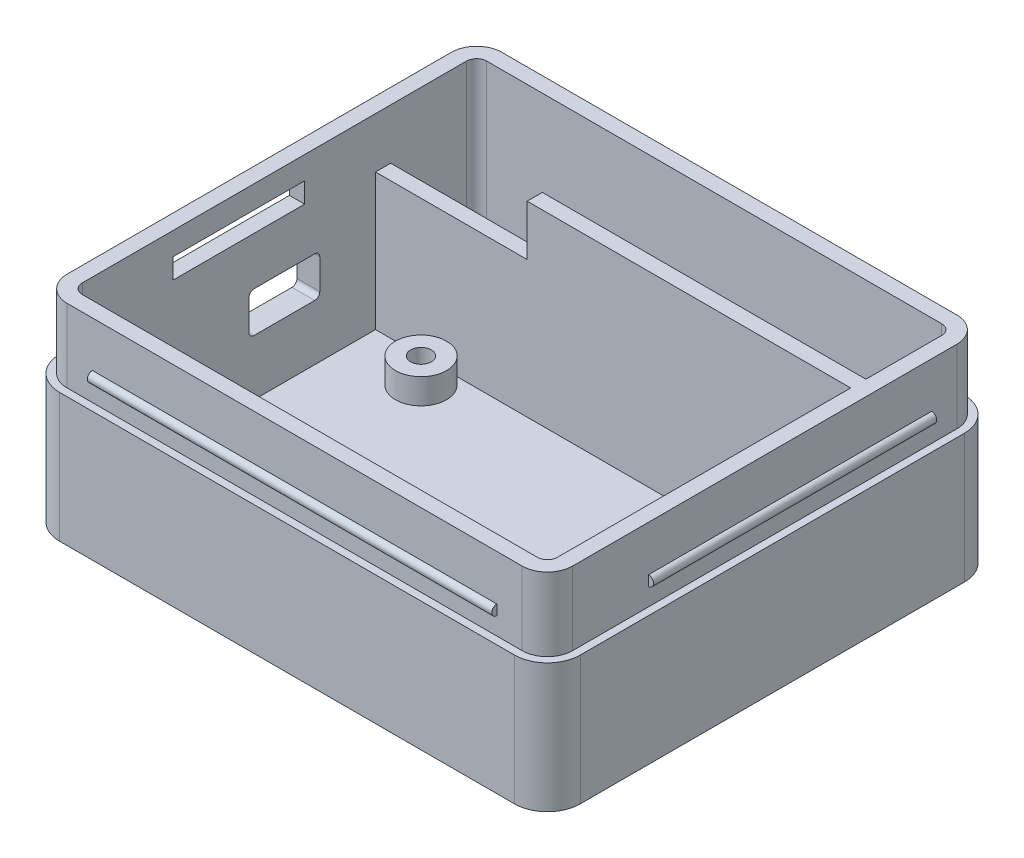
from build123d import *

# Parameters (mm, degrees)
ESQUISSE1_W             = 100
ESQUISSE1_H             = 66
BOSS_EXTRU_1_DEPTH      = 40
COQUE1_T                = -3
BOSS_EXTRU_2_DEPTH      = 40
ESQUISSE3_W             = 94
ESQUISSE3_H             = 17
BOSS_EXTRU_3_DEPTH      = 3
CONG_1_R                = 2
CONG_2_R                = 5
BOSS_EXTRU_4_START      = -10
BOSS_EXTRU_4_DEPTH      = 80
BOSS_EXTRU_5_START      = -10
BOSS_EXTRU_5_DEPTH      = 56
ESQUISSE6_W             = 30
ESQUISSE6_H             = 10
ENL_V_MAT_EXTRU_1_DEPTH = 5
ESQUISSE7_R             = 5.05
ESQUISSE7_R_2           = 5
BOSS_EXTRU_6_DEPTH      = 5
ESQUISSE8_R             = 2.05
ENL_V_MAT_EXTRU_2_DEPTH = 81.876448982
BOSS_EXTRU_7_START      = -25.5
BOSS_EXTRU_7_DEPTH      = 25.5
ESQUISSE11_W            = 14
ESQUISSE11_H            = 8
ENL_V_MAT_EXTRU_4_DEPTH = 10
CONG_3_R                = 1
ESQUISSE12_W            = 26
ESQUISSE12_H            = 4
ENL_V_MAT_EXTRU_5_DEPTH = 10


with BuildPart() as part:
    # Esquisse1 → Boss.-Extru.1 (new body)
    with BuildSketch(Plane(origin=(0, 0, 0), x_dir=(1, 0, 0), z_dir=(0, 1, 0))):
        Rectangle(ESQUISSE1_W, ESQUISSE1_H)
    extrude(amount=BOSS_EXTRU_1_DEPTH)

    # Coque1
    coque1_openings = [part.faces().sort_by_distance(p)[0] for p in [
        (0, 40, 0),
    ]]
    offset(amount=COQUE1_T, openings=coque1_openings, kind=Kind.INTERSECTION)

    # Esquisse2 → Boss.-Extru.2 (add)
    with BuildSketch(Plane.XZ):
        Polygon((-50, -33), (-50, -53), (50, -53), (50, -33), (47, -33), (47, -50), (-47, -50), (-47, -33), align=None)
    extrude(amount=-BOSS_EXTRU_2_DEPTH)

    # Esquisse3 → Boss.-Extru.3 (add)
    with BuildSketch(Plane.XZ):
        with Locations((0, -41.5)):
            Rectangle(ESQUISSE3_W, ESQUISSE3_H)
    extrude(amount=-BOSS_EXTRU_3_DEPTH)

    # Congé1
    cong_1_edges = [part.edges().sort_by_distance(p)[0] for p in [
        (47, 21.5, 30),
        (-47, 21.5, 30),
        (-47, 21.5, -50),
        (47, 21.5, -50),
    ]]
    fillet(cong_1_edges, radius=CONG_1_R)

    # Congé2
    cong_2_edges = [part.edges().sort_by_distance(p)[0] for p in [
        (50, 20, -53),
        (-50, 20, -53),
        (50, 20, 33),
        (-50, 20, 33),
    ]]
    fillet(cong_2_edges, radius=CONG_2_R)

    # Esquisse4 → Boss.-Extru.4 (add)
    with BuildSketch(Plane(origin=(50, 0, 0), x_dir=(0, 0, -1), z_dir=(1, 0, 0)).offset(BOSS_EXTRU_4_START)):
        with BuildLine():
            Line((-33, 31), (-33, 29))
            ThreePointArc((-33, 29), (-34, 30), (-33, 31))
        make_face()
    boss_extru_4 = extrude(amount=-BOSS_EXTRU_4_DEPTH)

    # Symétrie1: Boss.-Extru.4 across plane
    add(boss_extru_4.mirror(Plane(origin=(0, 0, -10), x_dir=(1, 0, 0), z_dir=(0, 0, -1))))

    # Esquisse5 → Boss.-Extru.5 (add)
    with BuildSketch(Plane(origin=(0, 0, -53), x_dir=(-1, 0, 0), z_dir=(0, 0, -1)).offset(BOSS_EXTRU_5_START)):
        with BuildLine():
            Line((50, 31), (50, 29))
            ThreePointArc((50, 29), (51, 30), (50, 31))
        make_face()
    boss_extru_5 = extrude(amount=-BOSS_EXTRU_5_DEPTH)

    # Symétrie2: Boss.-Extru.5 across plane
    add(boss_extru_5.mirror(Plane(origin=(0, 0, 0), x_dir=(0, 0, 1), z_dir=(1, 0, 0))))

    # Esquisse6 → Enlèv. mat.-Extru.1 (cut)
    with BuildSketch(Plane.XY.offset(-30)):
        with Locations((-32, 35)):
            Rectangle(ESQUISSE6_W, ESQUISSE6_H)
    extrude(amount=-ENL_V_MAT_EXTRU_1_DEPTH, mode=Mode.SUBTRACT)

    # Esquisse7 → Boss.-Extru.6 (add)
    with BuildSketch(Plane(origin=(0, 3, 0), x_dir=(1, 0, 0), z_dir=(0, 1, 0))):
        with Locations((-33, 25)):
            Circle(ESQUISSE7_R)
        with Locations(Location((-33, -24, 0), (0, 0, 90))):
            Circle(ESQUISSE7_R_2)
        with Locations(Location((39, -18, 0), (0, 0, 90))):
            Circle(ESQUISSE7_R_2)
        with Locations(Location((39, 10, 0), (0, 0, 90))):
            Circle(ESQUISSE7_R_2)
    extrude(amount=BOSS_EXTRU_6_DEPTH)

    # Esquisse8 → Enlèv. mat.-Extru.2 (cut, through all)
    with BuildSketch(Plane(origin=(0, 8, 0), x_dir=(1, 0, 0), z_dir=(0, 1, 0))):
        with Locations(Location((-33, 25, 0), (0, 0, 270))):
            Circle(ESQUISSE8_R)
        with Locations(Location((-33, -24, 0), (0, 0, 270))):
            Circle(ESQUISSE8_R)
        with Locations(Location((39, 10, 0), (0, 0, 270))):
            Circle(ESQUISSE8_R)
        with Locations(Location((39, -18, 0), (0, 0, 270))):
            Circle(ESQUISSE8_R)
    extrude(amount=-ENL_V_MAT_EXTRU_2_DEPTH, mode=Mode.SUBTRACT)

    # Esquisse10 → Boss.-Extru.7 (add)
    with BuildSketch(Plane.XZ.offset(BOSS_EXTRU_7_START)):
        with BuildLine():
            Line((-51.5, 28), (-51.5, -48))
            ThreePointArc((-51.5, -48), (-49.596194078, -52.596194078), (-45, -54.5))
            Line((-45, -54.5), (45, -54.5))
            ThreePointArc((45, -54.5), (49.596194078, -52.596194078), (51.5, -48))
            Line((51.5, -48), (51.5, 28))
            ThreePointArc((51.5, 28), (49.596194078, 32.596194078), (45, 34.5))
            Line((45, 34.5), (-45, 34.5))
            ThreePointArc((-45, 34.5), (-49.596194078, 32.596194078), (-51.5, 28))
        make_face()
        with BuildLine():
            Line((50, 28), (50, -48))
            ThreePointArc((50, -48), (48.535533906, -51.535533906), (45, -53))
            Line((45, -53), (-45, -53))
            ThreePointArc((-45, -53), (-48.535533906, -51.535533906), (-50, -48))
            Line((-50, -48), (-50, 28))
            ThreePointArc((-50, 28), (-48.535533906, 31.535533906), (-45, 33))
            Line((-45, 33), (45, 33))
            ThreePointArc((45, 33), (48.535533906, 31.535533906), (50, 28))
        make_face(mode=Mode.SUBTRACT)
    extrude(amount=BOSS_EXTRU_7_DEPTH)

    # Esquisse11 → Enlèv. mat.-Extru.4 (cut)
    with BuildSketch(Plane(origin=(-47, 0, 0), x_dir=(0, 0, -1), z_dir=(1, 0, 0))):
        with Locations((11.975, 18)):
            Rectangle(ESQUISSE11_W, ESQUISSE11_H)
    extrude(amount=-ENL_V_MAT_EXTRU_4_DEPTH, mode=Mode.SUBTRACT)

    # Congé3
    cong_3_edges = [part.edges().sort_by_distance(p)[0] for p in [
        (-49.25, 22, -18.975),
        (-49.25, 14, -18.975),
        (-49.25, 14, -4.975),
        (-49.25, 22, -4.975),
    ]]
    fillet(cong_3_edges, radius=CONG_3_R)

    # Esquisse12 → Enlèv. mat.-Extru.5 (cut)
    with BuildSketch(Plane(origin=(-47, 0, 0), x_dir=(0, 0, -1), z_dir=(1, 0, 0))):
        with Locations((2.975, 33.5)):
            Rectangle(ESQUISSE12_W, ESQUISSE12_H)
    extrude(amount=-ENL_V_MAT_EXTRU_5_DEPTH, mode=Mode.SUBTRACT)


solid = part.part
